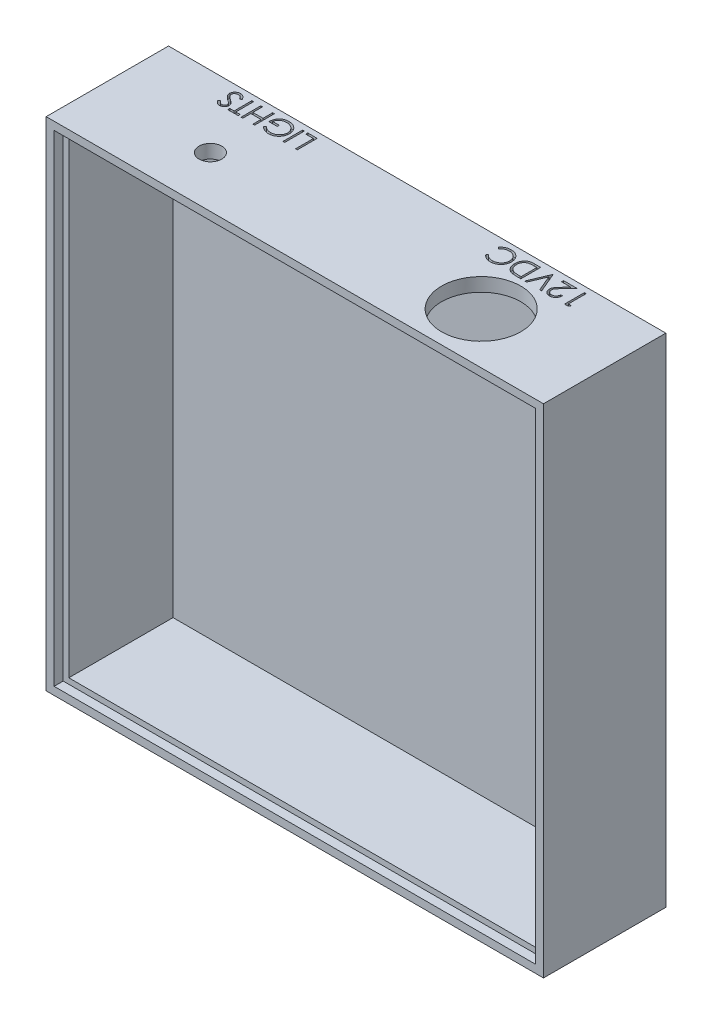
from build123d import *

# Parameters (mm, degrees)
SKETCH2_W                 = 87.8
SKETCH2_H                 = 87.8
SKETCH2_W_2               = 83
SKETCH2_H_2               = 83
BOSS_EXTRUDE1_WALLS_DEPTH = 20
SKETCH2_3_W               = 87.8
SKETCH2_3_H               = 87.8
BOSS_EXTRUDE2_BASE_DEPTH  = 1.6
CUT_EXTRUDE1_REACH        = 126.105
SKETCH3_R                 = 2
SKETCH3_R_2               = 7
SKETCH4_W                 = 0.314102564
SKETCH4_H                 = 3.5
CUT_EXTRUDE2_DEPTH        = 0.8
SKETCH6_W                 = 85
SKETCH6_H                 = 85
CUT_EXTRUDE3_DEPTH        = 1.6


with BuildPart() as part:
    # Sketch2 → Boss-Extrude1-Walls (new body)
    with BuildSketch(Plane.XY):
        with Locations((41.5, 41.5)):
            Rectangle(SKETCH2_W, SKETCH2_H)
        with Locations((41.5, 41.5)):
            Rectangle(SKETCH2_W_2, SKETCH2_H_2, mode=Mode.SUBTRACT)
    extrude(amount=BOSS_EXTRUDE1_WALLS_DEPTH)

    # Sketch2<3> → Boss-Extrude2-Base (add)
    with BuildSketch(Plane.XY):
        with Locations((41.5, 41.5)):
            Rectangle(SKETCH2_3_W, SKETCH2_3_H)
    extrude(amount=-BOSS_EXTRUDE2_BASE_DEPTH)

    # Sketch3 → Cut-Extrude1 (cut, up to next)
    with BuildSketch(Plane(origin=(0, 85.4, 0), x_dir=(1, 0, 0), z_dir=(0, 1, 0)), mode=Mode.PRIVATE) as cut_extrude1_sk1:
        with Locations((17.6, -11)):
            Circle(SKETCH3_R)
    cut_extrude1_tool1 = extrude(cut_extrude1_sk1.sketch, amount=-CUT_EXTRUDE1_REACH, mode=Mode.PRIVATE) & part.part
    # Sketch3 → Cut-Extrude1 (cut, up to next)
    with BuildSketch(Plane(origin=(0, 85.4, 0), x_dir=(1, 0, 0), z_dir=(0, 1, 0)), mode=Mode.PRIVATE) as cut_extrude1_sk2:
        with Locations((65.4, -11)):
            Circle(SKETCH3_R_2)
    cut_extrude1_tool2 = extrude(cut_extrude1_sk2.sketch, amount=-CUT_EXTRUDE1_REACH, mode=Mode.PRIVATE) & part.part
    add(cut_extrude1_tool1.solids().sort_by_distance((17.6, 85.4, 11))[0], mode=Mode.SUBTRACT)
    add(cut_extrude1_tool2.solids().sort_by_distance((65.4, 85.4, 11))[0], mode=Mode.SUBTRACT)

    # Sketch4 → Cut-Extrude2 (cut)
    # profile 1 of 11: a face of its own
    with BuildSketch(Plane(origin=(0, 85.4, 0), x_dir=(1, 0, 0), z_dir=(0, 1, 0))):
        Polygon((72.66572516, -2.9), (72.018589744, -2.9), (72.018589744, 0.6), (72.332692308, 0.6), (72.332692308, -2.541025641), (72.871153846, -2.541025641), align=None)
    # profile 2 of 11: a face of its own
    with BuildSketch(Plane(origin=(0, 85.4, 0), x_dir=(1, 0, 0), z_dir=(0, 1, 0))):
        with BuildLine():
            Line((70.268589744, -1.823076923), (70.582692308, -1.823076923))
            add(Edge.make_bspline(
                [(70.582692308, -1.823076923), (70.580645503, -1.864748016), (70.576625633, -1.946588934), (70.557792414, -2.065909934), (70.530869381, -2.179975252), (70.492713163, -2.287806988), (70.445593569, -2.390693283), (70.387905549, -2.487267925), (70.320878919, -2.578489406), (70.244636643, -2.662630601), (70.161906746, -2.739546174), (70.07318491, -2.806669589), (69.979383026, -2.86273344), (69.881314694, -2.9098564), (69.777845722, -2.945184955), (69.66996516, -2.971409677), (69.557185398, -2.987185182), (69.480345462, -2.988881084), (69.441266026, -2.98974359)],
                knots=[0, 0, 0, 0, 1.100776268, 2.161895295, 3.184016182, 4.190939212, 5.176500551, 6.166955529, 7.155448256, 8.160289653, 9.16017456, 10.133824356, 11.091467644, 12.04088621, 13.000931625, 13.972173743, 14.968683325, 16, 16, 16, 16], degree=3))
            add(Edge.make_bspline(
                [(69.441266026, -2.98974359), (69.402885251, -2.988852424), (69.327468399, -2.987101316), (69.217444592, -2.971837144), (69.112455493, -2.94844616), (69.013690942, -2.913784407), (68.920137338, -2.87029149), (68.83295303, -2.816202348), (68.75002981, -2.754076299), (68.675437405, -2.680795578), (68.606915283, -2.602604863), (68.547853356, -2.519097837), (68.496988761, -2.432749001), (68.455357678, -2.342883845), (68.423799465, -2.249209723), (68.400417855, -2.152624723), (68.387051662, -2.052014188), (68.38501156, -1.983905673), (68.383974359, -1.949278846)],
                knots=[0, 0, 0, 0, 1.111674182, 2.184400057, 3.212814286, 4.223731311, 5.211378316, 6.196328225, 7.191884489, 8.207283132, 9.220262353, 10.201199469, 11.166417575, 12.120932471, 13.06540007, 14.026332106, 14.996573967, 16, 16, 16, 16], degree=3))
            add(Edge.make_bspline(
                [(68.383974359, -1.949278846), (68.385667648, -1.900531033), (68.389024513, -1.803890861), (68.417738499, -1.66187569), (68.462586495, -1.524283442), (68.516579066, -1.413542366), (68.571062221, -1.324317319), (68.620110347, -1.250817554), (68.677855839, -1.171698892), (68.743805342, -1.086641103), (68.819094603, -0.99675809), (68.901767615, -0.900215998), (68.993959439, -0.798799957), (69.05860807, -0.729486308), (69.092107372, -0.693569712)],
                knots=[0, 0, 0, 0, 1.184416499, 2.348048165, 3.509039915, 4.696071444, 5.333504901, 6.05069495, 6.844171097, 7.714965912, 8.667477798, 9.695072654, 10.805644396, 12, 12, 12, 12], degree=3))
            Line((69.092107372, -0.693569712), (69.967808494, 0.241025641))
            Line((69.967808494, 0.241025641), (68.339102564, 0.241025641))
            Line((68.339102564, 0.241025641), (68.339102564, 0.6))
            Line((68.339102564, 0.6), (70.717307692, 0.6))
            Line((70.717307692, 0.6), (69.359935897, -0.848517628))
            add(Edge.make_bspline(
                [(69.359935897, -0.848517628), (69.326885671, -0.883014053), (69.26340295, -0.949274626), (69.173651156, -1.046042341), (69.092909946, -1.135709677), (69.021125762, -1.218673971), (68.958239538, -1.294464892), (68.904452483, -1.363676397), (68.859526867, -1.425714532), (68.811915077, -1.498594339), (68.766514075, -1.587681869), (68.72661124, -1.696003864), (68.702454607, -1.807759457), (68.699541993, -1.883257707), (68.698076923, -1.921233974)],
                knots=[0, 0, 0, 0, 1.329530082, 2.553755191, 3.672934919, 4.687409497, 5.60679272, 6.413407421, 7.126401618, 7.737995624, 8.834647426, 9.90044882, 10.943907757, 12, 12, 12, 12], degree=3))
            add(Edge.make_bspline(
                [(68.698076923, -1.921233974), (68.698706135, -1.945118012), (68.699946191, -1.992188863), (68.711097587, -2.061156757), (68.727481201, -2.127942288), (68.752733411, -2.1917197), (68.783073012, -2.253743372), (68.821834089, -2.31212759), (68.866127822, -2.368862533), (68.917506379, -2.422002807), (68.973910489, -2.47068755), (69.033506674, -2.513810711), (69.096556273, -2.549850063), (69.162796531, -2.579393496), (69.232041963, -2.602568894), (69.304426718, -2.618627469), (69.379750732, -2.628709954), (69.431184228, -2.630074126), (69.457391827, -2.630769231)],
                knots=[0, 0, 0, 0, 0.991504627, 1.954065223, 2.895985987, 3.842598665, 4.797835564, 5.759220273, 6.74786863, 7.784730864, 8.824135544, 9.839918996, 10.835834653, 11.835434876, 12.84861661, 13.863796685, 14.911511676, 16, 16, 16, 16], degree=3))
            add(Edge.make_bspline(
                [(69.457391827, -2.630769231), (69.484769651, -2.630082629), (69.538535178, -2.628734258), (69.617305242, -2.618514717), (69.692975263, -2.603037742), (69.764379185, -2.578398526), (69.833011367, -2.549561542), (69.897120966, -2.51222272), (69.958508902, -2.469557342), (70.015940952, -2.419812221), (70.068249139, -2.363657472), (70.115834364, -2.302534021), (70.156153798, -2.235358271), (70.191944952, -2.163742125), (70.219318119, -2.085717992), (70.242720215, -2.003194046), (70.259719158, -1.914992865), (70.265583771, -1.854224447), (70.268589744, -1.823076923)],
                knots=[0, 0, 0, 0, 1.031072318, 2.024855787, 2.988461151, 3.935103592, 4.865765533, 5.788564469, 6.724086513, 7.67908574, 8.64457978, 9.611397706, 10.591395687, 11.591555111, 12.622101007, 13.700900657, 14.821571223, 16, 16, 16, 16], degree=3))
        make_face()
    # profile 3 of 11: a face of its own
    with BuildSketch(Plane(origin=(0, 85.4, 0), x_dir=(1, 0, 0), z_dir=(0, 1, 0))):
        Polygon((67.980128205, -2.9), (67.643589744, -2.9), (66.476923077, -0.141786859), (65.31025641, -2.9), (64.973717949, -2.9), (66.454487179, 0.6), (66.499358974, 0.6), align=None)
    # profile 4 of 11: a face of its own
    with BuildSketch(Plane(origin=(0, 85.4, 0), x_dir=(1, 0, 0), z_dir=(0, 1, 0))):
        with BuildLine():
            Line((64.300641026, 0.6), (64.300641026, -2.9))
            Line((64.300641026, -2.9), (63.593910256, -2.9))
            add(Edge.make_bspline(
                [(63.593910256, -2.9), (63.53244114, -2.899558636), (63.413683128, -2.898705923), (63.242072392, -2.893268378), (63.083515101, -2.883746477), (62.938101296, -2.869609165), (62.805597359, -2.852640429), (62.68621551, -2.831060433), (62.579762282, -2.805680896), (62.51429297, -2.784034427), (62.483333333, -2.773798077)],
                knots=[0, 0, 0, 0, 1.314317071, 2.539253741, 3.67075822, 4.709970291, 5.662644612, 6.526156501, 7.303037452, 8, 8, 8, 8], degree=3))
            add(Edge.make_bspline(
                [(62.483333333, -2.773798077), (62.442834973, -2.758372159), (62.36275662, -2.727870133), (62.248802068, -2.670244323), (62.141162766, -2.605218736), (62.040688636, -2.53130256), (61.947158291, -2.449440357), (61.859394914, -2.360294457), (61.779914081, -2.261484964), (61.705974474, -2.156077903), (61.641258133, -2.043114046), (61.584190758, -1.924856045), (61.535463882, -1.801533354), (61.497443832, -1.672246144), (61.466032699, -1.538236169), (61.4449566, -1.39848881), (61.430956595, -1.253818803), (61.429556535, -1.155643076), (61.428846154, -1.105829327)],
                knots=[0, 0, 0, 0, 0.984696416, 1.947063185, 2.89840987, 3.841051395, 4.778753227, 5.721858861, 6.681155121, 7.65838316, 8.646299769, 9.637283673, 10.641736726, 11.657050558, 12.698485921, 13.768600492, 14.86780186, 16, 16, 16, 16], degree=3))
            add(Edge.make_bspline(
                [(61.428846154, -1.105829327), (61.429475546, -1.062568235), (61.430715828, -0.977317735), (61.44183907, -0.85167474), (61.458037585, -0.729768841), (61.483001292, -0.612135316), (61.513676117, -0.49798217), (61.551536672, -0.387849903), (61.596411042, -0.281663662), (61.648452567, -0.180266854), (61.705435913, -0.083906039), (61.767528623, 0.005892007), (61.832604683, 0.090117347), (61.903037533, 0.166867237), (61.976495214, 0.238531691), (62.055476124, 0.301931667), (62.137507277, 0.360010496), (62.225053127, 0.411004425), (62.318831955, 0.456365039), (62.421293397, 0.494672351), (62.532063498, 0.527638646), (62.651876242, 0.553903934), (62.780332044, 0.575075088), (62.917779116, 0.58917399), (63.063960081, 0.598734805), (63.164339677, 0.59957008), (63.216005609, 0.6)],
                knots=[0, 0, 0, 0, 1.105894396, 2.179280415, 3.222964075, 4.248423888, 5.251546139, 6.243661943, 7.223682738, 8.196462441, 9.155694589, 10.083899862, 10.986397372, 11.874737962, 12.745335529, 13.607670254, 14.461432187, 15.313100333, 16.195087267, 17.121790994, 18.106827133, 19.14775296, 20.255889161, 21.433815148, 22.679170477, 24, 24, 24, 24], degree=3))
            Line((63.216005609, 0.6), (64.300641026, 0.6))
        make_face()
        with BuildLine():
            Line((63.986538462, 0.241025641), (63.584795673, 0.241025641))
            add(Edge.make_bspline(
                [(63.584795673, 0.241025641), (63.527067302, 0.240777545), (63.416034504, 0.240300364), (63.256376507, 0.236113161), (63.11049711, 0.229271224), (62.978375601, 0.219696146), (62.860086576, 0.207027531), (62.755382827, 0.192902628), (62.664607568, 0.175305177), (62.609678131, 0.159354218), (62.584294872, 0.151983173)],
                knots=[0, 0, 0, 0, 1.375205317, 2.645023457, 3.804390687, 4.853969522, 5.800190428, 6.637939096, 7.370582563, 8, 8, 8, 8], degree=3))
            add(Edge.make_bspline(
                [(62.584294872, 0.151983173), (62.552345831, 0.140732455), (62.489210851, 0.118499743), (62.398339582, 0.077929927), (62.31354636, 0.029932705), (62.233417592, -0.023734894), (62.158468239, -0.083901549), (62.089045387, -0.150758605), (62.024600681, -0.223532044), (61.966165941, -0.302467077), (61.913316355, -0.386687881), (61.867654486, -0.476100641), (61.829162048, -0.570203604), (61.797581561, -0.668669372), (61.772959611, -0.771556546), (61.755624789, -0.879123322), (61.744882603, -0.991327221), (61.743600375, -1.067710676), (61.742948718, -1.106530449)],
                knots=[0, 0, 0, 0, 0.998420628, 1.972994, 2.929372424, 3.86770908, 4.81360496, 5.759023883, 6.706048443, 7.676227424, 8.651287839, 9.634325482, 10.632389399, 11.645655052, 12.680158286, 13.74837235, 14.855672678, 16, 16, 16, 16], degree=3))
            add(Edge.make_bspline(
                [(61.742948718, -1.106530449), (61.743462552, -1.147463684), (61.744471985, -1.227877387), (61.757138539, -1.345871557), (61.775688196, -1.459339618), (61.802370431, -1.568363263), (61.836841577, -1.67280065), (61.878089097, -1.773241804), (61.928170061, -1.868394145), (61.984867008, -1.959063575), (62.048519714, -2.043876965), (62.118845818, -2.121840679), (62.195103775, -2.193099946), (62.276942136, -2.257768222), (62.365505139, -2.31469547), (62.459294123, -2.365337062), (62.559630231, -2.40836517), (62.629444241, -2.431242353), (62.664923878, -2.44286859)],
                knots=[0, 0, 0, 0, 1.122272916, 2.204715076, 3.251197285, 4.274229216, 5.279697671, 6.265416158, 7.248880903, 8.225321784, 9.195852973, 10.153576302, 11.101466393, 12.055578741, 13.010401466, 13.985536859, 14.976245305, 16, 16, 16, 16], degree=3))
            add(Edge.make_bspline(
                [(62.664923878, -2.44286859), (62.694275025, -2.450985018), (62.756683615, -2.46824277), (62.858523079, -2.487068143), (62.973138228, -2.503672642), (63.101037929, -2.517730681), (63.242076389, -2.527818002), (63.396362077, -2.535389317), (63.563961681, -2.540495949), (63.680144215, -2.540844657), (63.740444712, -2.541025641)],
                knots=[0, 0, 0, 0, 0.674548936, 1.434276114, 2.292660221, 3.240891867, 4.284742987, 5.42552168, 6.663806718, 8, 8, 8, 8], degree=3))
            Line((63.740444712, -2.541025641), (63.986538462, -2.541025641))
            Line((63.986538462, -2.541025641), (63.986538462, 0.241025641))
        make_face(mode=Mode.SUBTRACT)
    # profile 5 of 11: a face of its own
    with BuildSketch(Plane(origin=(0, 85.4, 0), x_dir=(1, 0, 0), z_dir=(0, 1, 0))):
        with BuildLine():
            Line((57.480128205, -2.257772436), (57.754967949, -2.047435897))
            add(Edge.make_bspline(
                [(57.754967949, -2.047435897), (57.774574038, -2.070801558), (57.813521884, -2.11721786), (57.876178133, -2.182401946), (57.941490826, -2.243450218), (58.009369088, -2.30075492), (58.08138378, -2.352012856), (58.154790939, -2.401216038), (58.232257773, -2.444295117), (58.338835636, -2.496921601), (58.478801294, -2.550639943), (58.654386136, -2.596842354), (58.837931954, -2.625976532), (58.963124768, -2.629153365), (59.026802885, -2.630769231)],
                knots=[0, 0, 0, 0, 0.75789156, 1.505565099, 2.245254514, 2.979266606, 3.711207489, 4.440978832, 5.174393176, 5.91211879, 7.394186119, 8.890401545, 10.418332761, 12, 12, 12, 12], degree=3))
            add(Edge.make_bspline(
                [(59.026802885, -2.630769231), (59.061885758, -2.630363445), (59.131725901, -2.629555641), (59.235380668, -2.618973416), (59.337296201, -2.60392868), (59.437093512, -2.5821483), (59.53457445, -2.553792223), (59.630481246, -2.520538109), (59.723684399, -2.479156755), (59.815305486, -2.433456516), (59.903080871, -2.381823863), (59.986148028, -2.32552299), (60.064132316, -2.265110081), (60.137232061, -2.2007279), (60.204710673, -2.131624829), (60.267285006, -2.058577284), (60.324875191, -1.981255375), (60.377421809, -1.900028553), (60.424421444, -1.815298052), (60.465177764, -1.727427826), (60.499628818, -1.636753565), (60.527577688, -1.543469593), (60.549451615, -1.447906113), (60.564593031, -1.349720956), (60.575077762, -1.249085745), (60.575878448, -1.180876641), (60.576282051, -1.146494391)],
                knots=[0, 0, 0, 0, 1.054960097, 2.100129169, 3.131228542, 4.15308236, 5.169990287, 6.183953224, 7.204064171, 8.235355279, 9.262684623, 10.264978336, 11.252191258, 12.228402777, 13.192898315, 14.155264692, 15.119862721, 16.091023151, 17.063429752, 18.032246104, 19.00241354, 19.978852882, 20.959535218, 21.948948728, 22.966123959, 24, 24, 24, 24], degree=3))
            add(Edge.make_bspline(
                [(60.576282051, -1.146494391), (60.575017274, -1.094764224), (60.57253405, -0.993198904), (60.550527717, -0.844411923), (60.516818327, -0.701737065), (60.467124286, -0.566140367), (60.404626144, -0.436491469), (60.326645697, -0.314362627), (60.235988852, -0.197964618), (60.131725588, -0.090116535), (60.017316746, 0.008395797), (59.894569637, 0.095146748), (59.763785137, 0.167461533), (59.626408563, 0.227637506), (59.481382434, 0.273894226), (59.328967636, 0.306458351), (59.169495639, 0.327700531), (59.06052624, 0.32973422), (59.005068109, 0.330769231)],
                knots=[0, 0, 0, 0, 1.029159485, 2.020618137, 2.987588728, 3.942669054, 4.889339625, 5.846988364, 6.821327795, 7.821533711, 8.827683044, 9.822769455, 10.807800696, 11.797391277, 12.803701919, 13.832062008, 14.896664671, 16, 16, 16, 16], degree=3))
            add(Edge.make_bspline(
                [(59.005068109, 0.330769231), (58.94396542, 0.329080451), (58.823700711, 0.325756528), (58.647332685, 0.297597279), (58.478496919, 0.251939362), (58.317184333, 0.188041439), (58.163849686, 0.104976151), (58.018253026, 0.004278274), (57.880271456, -0.115010059), (57.797300173, -0.206093187), (57.754967949, -0.252564103)],
                knots=[0, 0, 0, 0, 1.028121516, 2.023589091, 2.998037872, 3.967518031, 4.937445131, 5.927275754, 6.942489185, 8, 8, 8, 8], degree=3))
            Line((57.754967949, -0.252564103), (57.480128205, -0.044330929))
            add(Edge.make_bspline(
                [(57.480128205, -0.044330929), (57.502247061, -0.015793416), (57.546378825, 0.041144917), (57.617825775, 0.121430551), (57.693144416, 0.196882567), (57.772538077, 0.267108013), (57.856110399, 0.332457902), (57.943824857, 0.392628369), (58.035243961, 0.448286885), (58.130482183, 0.498734792), (58.229544735, 0.543625001), (58.331582672, 0.582858942), (58.43678291, 0.615803401), (58.54431586, 0.643483567), (58.655286419, 0.663252493), (58.768424891, 0.678985532), (58.884784667, 0.688321615), (58.963217992, 0.689265346), (59.002964744, 0.68974359)],
                knots=[0, 0, 0, 0, 0.986880684, 1.969034265, 2.935876267, 3.899990983, 4.864973347, 5.834408638, 6.8063673, 7.789580233, 8.778939794, 9.778051223, 10.776304221, 11.791326552, 12.811423977, 13.855999788, 14.91350973, 16, 16, 16, 16], degree=3))
            add(Edge.make_bspline(
                [(59.002964744, 0.68974359), (59.040608411, 0.689481597), (59.115044101, 0.688963539), (59.224942852, 0.680571372), (59.331932433, 0.669121635), (59.435707059, 0.651881504), (59.536833034, 0.631537164), (59.634393619, 0.604265907), (59.729348829, 0.573716741), (59.82131717, 0.537811754), (59.910376869, 0.497295571), (59.996240681, 0.451504013), (60.078869113, 0.400822148), (60.159074534, 0.346367137), (60.235672118, 0.286389836), (60.309325643, 0.221723201), (60.380448119, 0.15258519), (60.424450804, 0.102730337), (60.446574519, 0.077664263)],
                knots=[0, 0, 0, 0, 1.114604814, 2.203992996, 3.262667896, 4.300477797, 5.318619304, 6.316056647, 7.298880507, 8.271930387, 9.238335007, 10.195173496, 11.151986948, 12.108099108, 13.064862484, 14.031167946, 15.010108607, 16, 16, 16, 16], degree=3))
            add(Edge.make_bspline(
                [(60.446574519, 0.077664263), (60.482007851, 0.034122176), (60.552446734, -0.05243632), (60.642606447, -0.192709076), (60.71952536, -0.339035305), (60.782411378, -0.492262553), (60.830715176, -0.652450387), (60.864675886, -0.819341112), (60.88659068, -0.992601104), (60.889106042, -1.110436232), (60.890384615, -1.170332532)],
                knots=[0, 0, 0, 0, 0.994611881, 1.977215934, 2.950189954, 3.921972279, 4.908960509, 5.911694611, 6.938501887, 8, 8, 8, 8], degree=3))
            add(Edge.make_bspline(
                [(60.890384615, -1.170332532), (60.888822466, -1.233285352), (60.885749034, -1.357141094), (60.859852519, -1.538952641), (60.817687989, -1.712890308), (60.759627151, -1.879623367), (60.683029381, -2.038197835), (60.590301586, -2.189283438), (60.48053804, -2.33275681), (60.355117267, -2.466783632), (60.217542684, -2.58931972), (60.070225765, -2.697126777), (59.913443319, -2.786844068), (59.748925601, -2.861840291), (59.575439883, -2.919484737), (59.393356524, -2.959837929), (59.203017606, -2.984955044), (59.073155181, -2.988130252), (59.007171474, -2.98974359)],
                knots=[0, 0, 0, 0, 1.032901378, 2.032168977, 3.007206631, 3.966850309, 4.924221947, 5.891988639, 6.871730993, 7.884084801, 8.900290346, 9.89161143, 10.874607481, 11.860025555, 12.854717796, 13.869097222, 14.917278314, 16, 16, 16, 16], degree=3))
            add(Edge.make_bspline(
                [(59.007171474, -2.98974359), (58.966957056, -2.989261392), (58.887356664, -2.988306931), (58.76960324, -2.979001647), (58.654963747, -2.963484886), (58.543119273, -2.942338117), (58.433885337, -2.916035602), (58.327752845, -2.883101378), (58.225025896, -2.843281725), (58.1250118, -2.798963437), (58.028992905, -2.748207032), (57.937016974, -2.693037102), (57.849830833, -2.632391261), (57.766867732, -2.567154008), (57.688511232, -2.496823482), (57.613585366, -2.422581847), (57.544314845, -2.3424597), (57.501562918, -2.286053199), (57.480128205, -2.257772436)],
                knots=[0, 0, 0, 0, 1.096566765, 2.170543479, 3.218870886, 4.250164525, 5.273529809, 6.281496242, 7.278154839, 8.276706968, 9.263143576, 10.238168486, 11.199979644, 12.157579042, 13.114563119, 14.070017788, 15.032356758, 16, 16, 16, 16], degree=3))
        make_face()
    # profile 6 of 11: a face of its own
    with BuildSketch(Plane(origin=(0, 85.4, 0), x_dir=(1, 0, 0), z_dir=(0, 1, 0))):
        Polygon((24.846794872, -2.9), (24.532692308, -2.9), (24.532692308, 0.241025641), (23.186538462, 0.241025641), (23.186538462, 0.6), (24.846794872, 0.6), align=None)
    # profile 7 of 11: a face of its own
    with BuildSketch(Plane(origin=(0, 85.4, 0), x_dir=(1, 0, 0), z_dir=(0, 1, 0))):
        with Locations((22.446153846, -1.15)):
            Rectangle(SKETCH4_W, SKETCH4_H)
    # profile 8 of 11: a face of its own
    with BuildSketch(Plane(origin=(0, 85.4, 0), x_dir=(1, 0, 0), z_dir=(0, 1, 0))):
        with BuildLine():
            Line((18.250641026, -2.302644231), (18.519871795, -2.047435897))
            add(Edge.make_bspline(
                [(18.519871795, -2.047435897), (18.568875959, -2.093203826), (18.665455602, -2.18340535), (18.822160473, -2.301745684), (18.985883835, -2.402331589), (19.155294609, -2.484970576), (19.327125917, -2.549208767), (19.497947144, -2.595656368), (19.666560668, -2.625527847), (19.778501332, -2.629036681), (19.833774038, -2.630769231)],
                knots=[0, 0, 0, 0, 1.091957225, 2.152079168, 3.193085318, 4.218301889, 5.218403563, 6.17723952, 7.099979378, 8, 8, 8, 8], degree=3))
            add(Edge.make_bspline(
                [(19.833774038, -2.630769231), (19.867688548, -2.630355014), (19.935429608, -2.629527655), (20.036054386, -2.61899253), (20.135610387, -2.60379354), (20.233754298, -2.582028441), (20.330876325, -2.553759258), (20.426760411, -2.519628436), (20.521221498, -2.478542206), (20.61376265, -2.431700143), (20.703935566, -2.380564325), (20.788743673, -2.323532746), (20.868540631, -2.262360437), (20.942762154, -2.196245136), (21.012424911, -2.126287257), (21.07625369, -2.051492779), (21.135644335, -1.97296873), (21.188375432, -1.889589525), (21.236036562, -1.803724246), (21.27730704, -1.71605735), (21.312843312, -1.627207134), (21.341238963, -1.537123512), (21.36406798, -1.445864007), (21.380226655, -1.353571203), (21.389302544, -1.259790374), (21.390875779, -1.196993538), (21.391666667, -1.165424679)],
                knots=[0, 0, 0, 0, 1.028307134, 2.053947307, 3.065600992, 4.082111276, 5.100671203, 6.132125737, 7.167228006, 8.222953114, 9.277225349, 10.309459149, 11.320441984, 12.324791754, 13.322338422, 14.312705492, 15.305176196, 16.306142747, 17.302479595, 18.282363326, 19.243345101, 20.20291386, 21.145121196, 22.094978082, 23.042318507, 24, 24, 24, 24], degree=3))
            add(Edge.make_bspline(
                [(21.391666667, -1.165424679), (21.390903723, -1.133155828), (21.389379918, -1.068706241), (21.379827502, -0.972482814), (21.361501539, -0.877884639), (21.339116597, -0.784019283), (21.307431322, -0.692084814), (21.270598176, -0.600734884), (21.22618566, -0.510818478), (21.175043656, -0.422962356), (21.118526252, -0.33746472), (21.05637719, -0.256251574), (20.988479091, -0.180272032), (20.916080299, -0.108415242), (20.838520262, -0.041134977), (20.755046741, 0.020757879), (20.666828146, 0.078220357), (20.573825357, 0.130621193), (20.477021378, 0.17742856), (20.377764946, 0.21905277), (20.275737045, 0.253332024), (20.171474378, 0.28127015), (20.0651011, 0.304170441), (19.956077299, 0.318902923), (19.84520459, 0.329593754), (19.770465958, 0.330375424), (19.7328125, 0.330769231)],
                knots=[0, 0, 0, 0, 0.935896426, 1.86923723, 2.799743935, 3.728471844, 4.66505513, 5.616527375, 6.583419551, 7.570341864, 8.562833498, 9.553750335, 10.533080376, 11.5155245, 12.510142773, 13.507781369, 14.526649666, 15.561487327, 16.601173999, 17.643331812, 18.680652164, 19.71969803, 20.772446191, 21.833473655, 22.9085001, 24, 24, 24, 24], degree=3))
            add(Edge.make_bspline(
                [(19.7328125, 0.330769231), (19.687433968, 0.329821048), (19.598325847, 0.327959137), (19.467342029, 0.313453264), (19.341529402, 0.2908268), (19.221297599, 0.257587727), (19.106210078, 0.215515357), (18.996692055, 0.163486487), (18.892438333, 0.10205028), (18.793910532, 0.032444359), (18.703412881, -0.045089376), (18.621155622, -0.128076961), (18.549549177, -0.217180559), (18.488126558, -0.312380778), (18.435259368, -0.412275828), (18.393087906, -0.518577893), (18.360470313, -0.630099635), (18.347126853, -0.707197518), (18.340384615, -0.746153846)],
                knots=[0, 0, 0, 0, 1.130234505, 2.219399076, 3.279128566, 4.311639422, 5.322903917, 6.328167287, 7.327698761, 8.334124803, 9.329374007, 10.292761544, 11.24113083, 12.171311216, 13.111441694, 14.052040787, 15.015727358, 16, 16, 16, 16], degree=3))
            Line((18.340384615, -0.746153846), (19.507051282, -0.746153846))
            Line((19.507051282, -0.746153846), (19.507051282, -1.105128205))
            Line((19.507051282, -1.105128205), (18.026282051, -1.105128205))
            add(Edge.make_bspline(
                [(18.026282051, -1.105128205), (18.0279879, -1.038220716), (18.031326553, -0.907270675), (18.054745469, -0.716300404), (18.092561981, -0.53592871), (18.144222293, -0.365965639), (18.211097573, -0.206652046), (18.292470102, -0.05782618), (18.389642223, 0.079550501), (18.499152664, 0.206599505), (18.622052622, 0.319928717), (18.755021242, 0.419534655), (18.89827821, 0.50343727), (19.051688018, 0.571697933), (19.214748451, 0.624971927), (19.387836831, 0.662743504), (19.570718432, 0.685373467), (19.696055109, 0.688264847), (19.76015625, 0.68974359)],
                knots=[0, 0, 0, 0, 1.140356446, 2.231883559, 3.274166699, 4.278491846, 5.25512956, 6.21435461, 7.1637429, 8.11826594, 9.068280886, 10.0076534, 10.945064095, 11.891975133, 12.864533718, 13.863980011, 14.907571808, 16, 16, 16, 16], degree=3))
            add(Edge.make_bspline(
                [(19.76015625, 0.68974359), (19.799666385, 0.689174469), (19.877593106, 0.688051978), (19.992684034, 0.680074631), (20.104601655, 0.667794054), (20.213329664, 0.649248931), (20.319268006, 0.626534277), (20.421887591, 0.597447558), (20.521579333, 0.563778859), (20.618497319, 0.525483185), (20.711761865, 0.481111528), (20.801788382, 0.431801889), (20.889074508, 0.377808528), (20.973025673, 0.318197682), (21.054079294, 0.253415222), (21.131712738, 0.183331303), (21.206360616, 0.108160184), (21.25312108, 0.054781174), (21.276682692, 0.027884615)],
                knots=[0, 0, 0, 0, 1.107784379, 2.184907829, 3.233506516, 4.263428166, 5.276301166, 6.270063455, 7.25232949, 8.225834625, 9.190232166, 10.146266622, 11.1027726, 12.066435141, 13.031522626, 14.010570082, 14.99756817, 16, 16, 16, 16], degree=3))
            add(Edge.make_bspline(
                [(21.276682692, 0.027884615), (21.310868624, -0.014786038), (21.378673037, -0.099419055), (21.465951193, -0.235018999), (21.540352596, -0.375420859), (21.600720418, -0.521015488), (21.647858505, -0.671666701), (21.681664758, -0.827181992), (21.701472047, -0.987761622), (21.704325584, -1.096426887), (21.705769231, -1.151402244)],
                knots=[0, 0, 0, 0, 1.023165419, 2.029347347, 3.013907458, 3.994755782, 4.975994455, 5.96558838, 6.970761222, 8, 8, 8, 8], degree=3))
            add(Edge.make_bspline(
                [(21.705769231, -1.151402244), (21.705235551, -1.192568064), (21.704174973, -1.274376511), (21.691370671, -1.395840185), (21.672889895, -1.515117061), (21.646121202, -1.632317577), (21.610900312, -1.746921415), (21.568601377, -1.859809183), (21.519057293, -1.970529677), (21.461241164, -2.078101551), (21.398308977, -2.182488017), (21.327542725, -2.28040349), (21.252873599, -2.373741247), (21.170724288, -2.459858718), (21.084173113, -2.541507007), (20.991067241, -2.616534119), (20.892934207, -2.686205896), (20.788981625, -2.74915898), (20.680858385, -2.805727139), (20.568797194, -2.855315137), (20.452839405, -2.89629878), (20.33385184, -2.931072471), (20.210934363, -2.956787636), (20.08497882, -2.975436374), (19.955328709, -2.988196976), (19.86769268, -2.989223231), (19.823257212, -2.98974359)],
                knots=[0, 0, 0, 0, 1.009025537, 2.005226976, 2.991671811, 3.967589759, 4.950148279, 5.929425679, 6.922109907, 7.921964004, 8.922507644, 9.908469609, 10.882248289, 11.851158214, 12.824245259, 13.798023939, 14.780666017, 15.773333703, 16.775582742, 17.771174102, 18.775387309, 19.789283316, 20.80873549, 21.851817535, 22.910773411, 24, 24, 24, 24], degree=3))
            add(Edge.make_bspline(
                [(19.823257212, -2.98974359), (19.787018703, -2.989165546), (19.715161998, -2.988019354), (19.608240145, -2.980033511), (19.503181463, -2.967516305), (19.399458937, -2.950013088), (19.297467499, -2.92685917), (19.196898146, -2.898641244), (19.09794109, -2.865970338), (19.000714055, -2.826975872), (18.904556008, -2.782723779), (18.808934258, -2.732909935), (18.714174987, -2.676685048), (18.620114013, -2.61388148), (18.526158153, -2.545578071), (18.433793511, -2.469821245), (18.340790567, -2.389598489), (18.280988753, -2.331916305), (18.250641026, -2.302644231)],
                knots=[0, 0, 0, 0, 0.985875312, 1.954874891, 2.915472732, 3.863573565, 4.815313299, 5.759461513, 6.704487138, 7.649063459, 8.607849844, 9.583336382, 10.581114205, 11.603942397, 12.659508253, 13.739925933, 14.853076422, 16, 16, 16, 16], degree=3))
        make_face()
    # profile 9 of 11: a face of its own
    with BuildSketch(Plane(origin=(0, 85.4, 0), x_dir=(1, 0, 0), z_dir=(0, 1, 0))):
        Polygon((17.308333333, -2.9), (16.994230769, -2.9), (16.994230769, -1.464102564), (15.199358974, -1.464102564), (15.199358974, -2.9), (14.88525641, -2.9), (14.88525641, 0.6), (15.199358974, 0.6), (15.199358974, -1.105128205), (16.994230769, -1.105128205), (16.994230769, 0.6), (17.308333333, 0.6), align=None)
    # profile 10 of 11: a face of its own
    with BuildSketch(Plane(origin=(0, 85.4, 0), x_dir=(1, 0, 0), z_dir=(0, 1, 0))):
        Polygon((14.391666667, -2.541025641), (14.391666667, -2.9), (12.551923077, -2.9), (12.551923077, -2.541025641), (13.31474359, -2.541025641), (13.31474359, 0.6), (13.628846154, 0.6), (13.628846154, -2.541025641), align=None)
    # profile 11 of 11: a face of its own
    with BuildSketch(Plane(origin=(0, 85.4, 0), x_dir=(1, 0, 0), z_dir=(0, 1, 0))):
        with BuildLine():
            Line((12.282692308, -0.075180288), (11.98681891, -0.252564103))
            add(Edge.make_bspline(
                [(11.98681891, -0.252564103), (11.959300673, -0.206499718), (11.906576792, -0.118242134), (11.818625433, 0.001015907), (11.727492522, 0.102378063), (11.632503189, 0.185254671), (11.53423724, 0.250503558), (11.432053187, 0.296705789), (11.326295376, 0.325521765), (11.254321554, 0.329021851), (11.218389423, 0.330769231)],
                knots=[0, 0, 0, 0, 1.272034388, 2.437168799, 3.508375237, 4.49857839, 5.41946034, 6.295179144, 7.148887113, 8, 8, 8, 8], degree=3))
            add(Edge.make_bspline(
                [(11.218389423, 0.330769231), (11.187708772, 0.329894226), (11.126884309, 0.328159528), (11.037165456, 0.312164711), (10.95046627, 0.285997308), (10.867649647, 0.250524259), (10.790905851, 0.206921242), (10.722540247, 0.155501352), (10.664776056, 0.096100786), (10.617020738, 0.030861281), (10.579637084, -0.038855347), (10.553037724, -0.111332164), (10.535950872, -0.186107329), (10.533784504, -0.236815018), (10.532692308, -0.262379808)],
                knots=[0, 0, 0, 0, 1.095645842, 2.172120455, 3.244862764, 4.326153987, 5.384857088, 6.392105572, 7.372507978, 8.334705661, 9.272564127, 10.189475455, 11.087205874, 12, 12, 12, 12], degree=3))
            add(Edge.make_bspline(
                [(10.532692308, -0.262379808), (10.534134953, -0.291530384), (10.537056468, -0.350563479), (10.562803972, -0.437808896), (10.602119334, -0.524521158), (10.639071355, -0.578168381), (10.658193109, -0.605929487)],
                knots=[0, 0, 0, 0, 0.938992559, 1.901562324, 2.914110574, 4, 4, 4, 4], degree=3))
            add(Edge.make_bspline(
                [(10.658193109, -0.605929487), (10.673817057, -0.626019832), (10.706713862, -0.668320803), (10.76410113, -0.730181515), (10.82935407, -0.795680591), (10.904162103, -0.863510683), (10.987434368, -0.935059306), (11.080114938, -1.008999506), (11.181121624, -1.086434071), (11.252364581, -1.137577375), (11.289202724, -1.164022436)],
                knots=[0, 0, 0, 0, 0.722283655, 1.520795216, 2.39349503, 3.346893347, 4.386874146, 5.510198126, 6.712579003, 8, 8, 8, 8], degree=3))
            add(Edge.make_bspline(
                [(11.289202724, -1.164022436), (11.326021809, -1.190257027), (11.396417094, -1.240415567), (11.494939178, -1.314762239), (11.582921488, -1.383169392), (11.660812337, -1.444684139), (11.726596591, -1.501989442), (11.782679138, -1.552014057), (11.826990881, -1.597429242), (11.851649321, -1.626867212), (11.862720353, -1.640084135)],
                knots=[0, 0, 0, 0, 1.452255772, 2.776602448, 3.96446981, 5.032613149, 5.964194703, 6.766668629, 7.446264616, 8, 8, 8, 8], degree=3))
            add(Edge.make_bspline(
                [(11.862720353, -1.640084135), (11.878190304, -1.660686194), (11.908614041, -1.701202909), (11.948817002, -1.764513194), (11.982720268, -1.82919828), (12.010006058, -1.8954926), (12.032071043, -1.962897912), (12.047411869, -2.03192027), (12.056867629, -2.102091109), (12.057844382, -2.149302975), (12.058333333, -2.172936699)],
                knots=[0, 0, 0, 0, 1.068019517, 2.100403715, 3.106014851, 4.09224787, 5.069873182, 6.043214339, 7.020455327, 8, 8, 8, 8], degree=3))
            add(Edge.make_bspline(
                [(12.058333333, -2.172936699), (12.057033876, -2.209969646), (12.054462736, -2.283243988), (12.032538773, -2.390228785), (11.998343292, -2.492687328), (11.948870271, -2.588339257), (11.887761834, -2.677048981), (11.815226003, -2.757242864), (11.729904387, -2.826160536), (11.63491964, -2.884746065), (11.532165719, -2.931484251), (11.424177376, -2.965540621), (11.31143985, -2.985499733), (11.23482721, -2.988315071), (11.195953526, -2.98974359)],
                knots=[0, 0, 0, 0, 1.005367131, 1.989245246, 2.955191616, 3.932180104, 4.904534562, 5.875498653, 6.859376768, 7.874484044, 8.900379497, 9.918679785, 10.943926428, 12, 12, 12, 12], degree=3))
            add(Edge.make_bspline(
                [(11.195953526, -2.98974359), (11.154696679, -2.988366889), (11.072879419, -2.985636728), (10.952494896, -2.960438723), (10.835897055, -2.921287603), (10.742453036, -2.874659374), (10.669292422, -2.828590757), (10.613558259, -2.786523199), (10.556771797, -2.738197785), (10.499544888, -2.68259076), (10.441312117, -2.620815789), (10.382341855, -2.552349505), (10.322082201, -2.47780903), (10.28332852, -2.424582252), (10.263461538, -2.397295673)],
                knots=[0, 0, 0, 0, 1.286534051, 2.551350862, 3.822568981, 5.117864672, 5.799956111, 6.519305446, 7.295594771, 8.126302591, 9.008831062, 9.944975596, 10.946496709, 12, 12, 12, 12], degree=3))
            Line((10.263461538, -2.397295673), (10.547415865, -2.182051282))
            add(Edge.make_bspline(
                [(10.547415865, -2.182051282), (10.564560548, -2.204141251), (10.597577197, -2.246681368), (10.647723315, -2.30623567), (10.694915606, -2.360709801), (10.741767269, -2.407900268), (10.784666827, -2.451341404), (10.82704332, -2.487872744), (10.867259685, -2.518654044), (10.917836242, -2.551546496), (10.982068611, -2.583370186), (11.061947624, -2.610730974), (11.145478555, -2.627545801), (11.20218586, -2.629682943), (11.231009615, -2.630769231)],
                knots=[0, 0, 0, 0, 1.181426797, 2.275151783, 3.28963443, 4.225459815, 5.084396437, 5.868484344, 6.587427557, 7.222918358, 8.415355282, 9.605213164, 10.782753814, 12, 12, 12, 12], degree=3))
            add(Edge.make_bspline(
                [(11.231009615, -2.630769231), (11.26717467, -2.629577372), (11.336915572, -2.627278984), (11.435696563, -2.60151661), (11.52511801, -2.562346657), (11.601766265, -2.505863992), (11.665053541, -2.438525777), (11.711401237, -2.361731285), (11.73911171, -2.276914756), (11.742503424, -2.217777772), (11.744230769, -2.187660256)],
                knots=[0, 0, 0, 0, 1.144248881, 2.206576175, 3.214949548, 4.222996039, 5.203671638, 6.127710127, 7.046472867, 8, 8, 8, 8], degree=3))
            add(Edge.make_bspline(
                [(11.744230769, -2.187660256), (11.743796607, -2.168918005), (11.742922235, -2.131172416), (11.732497595, -2.07552052), (11.716941005, -2.020523775), (11.694889968, -1.96586532), (11.664922349, -1.909987982), (11.62422106, -1.853210253), (11.573288787, -1.794111133), (11.534199608, -1.755710877), (11.513561699, -1.735436699)],
                knots=[0, 0, 0, 0, 0.858500039, 1.728959331, 2.587258638, 3.476905708, 4.426389682, 5.487945037, 6.673710648, 8, 8, 8, 8], degree=3))
            add(Edge.make_bspline(
                [(11.513561699, -1.735436699), (11.505900326, -1.728599673), (11.487698659, -1.712356465), (11.454422733, -1.685764184), (11.410479935, -1.652961412), (11.357017734, -1.612374095), (11.293050372, -1.565292633), (11.218570816, -1.512319021), (11.134409283, -1.451733562), (11.074687367, -1.409376021), (11.043108974, -1.386979167)],
                knots=[0, 0, 0, 0, 0.420754252, 0.999615792, 1.744751191, 2.668019286, 3.750313428, 4.999500688, 6.413464383, 8, 8, 8, 8], degree=3))
            add(Edge.make_bspline(
                [(11.043108974, -1.386979167), (11.005123088, -1.359337788), (10.931568683, -1.305814088), (10.826910741, -1.225398672), (10.732018174, -1.146749999), (10.646550801, -1.07037543), (10.569687779, -0.996837219), (10.502203933, -0.925307648), (10.443793071, -0.856255798), (10.380050819, -0.768329044), (10.31569004, -0.659340613), (10.260505961, -0.525749038), (10.225398796, -0.391774097), (10.220839343, -0.301843194), (10.218589744, -0.257471955)],
                knots=[0, 0, 0, 0, 1.163604038, 2.253157948, 3.268574773, 4.215621239, 5.091738613, 5.902582348, 6.650434646, 7.330118262, 8.591011492, 9.77460283, 10.902005569, 12, 12, 12, 12], degree=3))
            add(Edge.make_bspline(
                [(10.218589744, -0.257471955), (10.219247917, -0.22609417), (10.220551482, -0.163947935), (10.235497344, -0.072684425), (10.257472989, 0.015915082), (10.290225044, 0.100748007), (10.331166063, 0.182759819), (10.381011428, 0.261806721), (10.441418334, 0.336589887), (10.508523159, 0.408561627), (10.583059642, 0.47365295), (10.661934459, 0.531628769), (10.744704905, 0.581268959), (10.832316203, 0.620267395), (10.923325156, 0.651462808), (11.018158968, 0.67382286), (11.117021418, 0.687592901), (11.184222871, 0.68901869), (11.218389423, 0.68974359)],
                knots=[0, 0, 0, 0, 0.98378539, 1.948466333, 2.894822735, 3.844243623, 4.795447569, 5.768042124, 6.770299647, 7.807997672, 8.852593179, 9.870666288, 10.876941106, 11.874841786, 12.874492863, 13.892063892, 14.928283473, 16, 16, 16, 16], degree=3))
            add(Edge.make_bspline(
                [(11.218389423, 0.68974359), (11.244823599, 0.689226551), (11.297359041, 0.688198984), (11.374856739, 0.679329854), (11.45093134, 0.666323161), (11.524627657, 0.646492684), (11.596863259, 0.621866319), (11.66699458, 0.591715125), (11.735190795, 0.555820812), (11.801536147, 0.51412786), (11.866637884, 0.466065675), (11.930233264, 0.410572817), (11.992640641, 0.34791491), (12.054119251, 0.278179147), (12.113220885, 0.200212847), (12.171431774, 0.115252463), (12.228448811, 0.02302352), (12.264273424, -0.041834272), (12.282692308, -0.075180288)],
                knots=[0, 0, 0, 0, 0.915366252, 1.81920441, 2.69897508, 3.586533125, 4.459536084, 5.340758185, 6.227946952, 7.126403341, 8.052553006, 9.028121456, 10.047063623, 11.114014537, 12.24582441, 13.433687931, 14.680555077, 16, 16, 16, 16], degree=3))
        make_face()
    extrude(amount=-CUT_EXTRUDE2_DEPTH, mode=Mode.SUBTRACT)

    # Sketch6 → Cut-Extrude3 (cut)
    with BuildSketch(Plane.XY.offset(20)):
        with Locations((41.5, 41.5)):
            Rectangle(SKETCH6_W, SKETCH6_H)
    extrude(amount=-CUT_EXTRUDE3_DEPTH, mode=Mode.SUBTRACT)


solid = part.part
